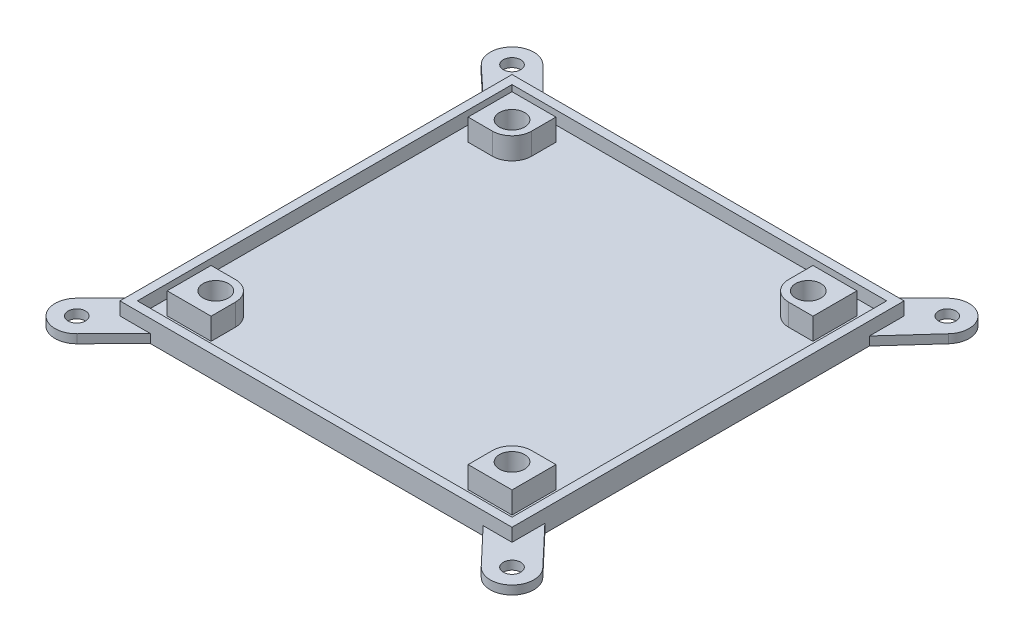
from build123d import *

# Parameters (mm, degrees)
BOSS_EXTRUDE1_DEPTH  = 5
BOSS_EXTRUDE2_DEPTH  = 2
SKETCH1_9_R          = 2.9
BOSS_EXTRUDE11_DEPTH = 7
BOSS_EXTRUDE12_DEPTH = 2
SKETCH2_R            = 2
BOSS_EXTRUDE13_DEPTH = 2


with BuildPart() as part:
    # Sketch1 → Boss-Extrude1 (new body)
    with BuildSketch(Plane(origin=(0, 0, 0), x_dir=(1, 0, 0), z_dir=(0, 1, 0))):
        Polygon((-170.560874466, -191.147776914), (-168.560874466, -191.147776914), (-168.560874466, -101.147776914), (-258.560874466, -101.147776914), (-258.560874466, -191.147776914), align=None)
        Polygon((-170.560874466, -103.147776914), (-170.560874466, -189.147776914), (-173.980874466, -189.147776914), (-256.560874466, -189.147776914), (-256.560874466, -103.147776914), align=None, mode=Mode.SUBTRACT)
    extrude(amount=BOSS_EXTRUDE1_DEPTH)

    # Sketch1<3> → Boss-Extrude2 (add)
    with BuildSketch(Plane(origin=(0, 0, 0), x_dir=(1, 0, 0), z_dir=(0, 1, 0))):
        Polygon((-173.980874466, -189.147776914), (-170.560874466, -189.147776914), (-170.560874466, -103.147776914), (-256.560874466, -103.147776914), (-256.560874466, -189.147776914), align=None)
        Polygon((-173.980874466, -175.647776914), (-173.980874466, -185.727776914), (-176.060874466, -185.727776914), (-184.060874466, -185.727776914), (-243.060874466, -185.727776914), (-253.140874466, -185.727776914), (-253.140874466, -175.647776914), (-253.140874466, -116.647776914), (-253.140874466, -106.567776914), (-243.060874466, -106.567776914), (-184.060874466, -106.567776914), (-173.980874466, -106.567776914), (-173.980874466, -116.647776914), align=None, mode=Mode.SUBTRACT)
    extrude(amount=BOSS_EXTRUDE2_DEPTH)

    # Sketch1<9> → Boss-Extrude11 (add)
    # profile 1 of 4: a face of its own
    with BuildSketch(Plane(origin=(0, 0, 0), x_dir=(1, 0, 0), z_dir=(0, 1, 0))):
        with BuildLine():
            Line((-173.980874466, -185.727776914), (-173.980874466, -175.647776914))
            Line((-173.980874466, -175.647776914), (-179.560874466, -175.647776914))
            ThreePointArc((-179.560874466, -175.647776914), (-182.742854981, -176.965796398), (-184.060874466, -180.147776914))
            Line((-184.060874466, -180.147776914), (-184.060874466, -185.727776914))
            Line((-184.060874466, -185.727776914), (-173.980874466, -185.727776914))
        make_face()
        with Locations((-179.560874466, -180.147776914)):
            Circle(SKETCH1_9_R, mode=Mode.SUBTRACT)
    # profile 2 of 4: a face of its own
    with BuildSketch(Plane(origin=(0, 0, 0), x_dir=(1, 0, 0), z_dir=(0, 1, 0))):
        with BuildLine():
            Line((-173.980874466, -116.647776914), (-173.980874466, -106.567776914))
            Line((-173.980874466, -106.567776914), (-184.060874466, -106.567776914))
            Line((-184.060874466, -106.567776914), (-184.060874466, -112.147776914))
            ThreePointArc((-184.060874466, -112.147776914), (-182.742854981, -115.329757429), (-179.560874466, -116.647776914))
            Line((-179.560874466, -116.647776914), (-173.980874466, -116.647776914))
        make_face()
        with Locations((-179.560874466, -112.147776914)):
            Circle(SKETCH1_9_R, mode=Mode.SUBTRACT)
    # profile 3 of 4: a face of its own
    with BuildSketch(Plane(origin=(0, 0, 0), x_dir=(1, 0, 0), z_dir=(0, 1, 0))):
        with BuildLine():
            Line((-253.140874466, -185.727776914), (-243.060874466, -185.727776914))
            Line((-243.060874466, -185.727776914), (-243.060874466, -180.147776914))
            ThreePointArc((-243.060874466, -180.147776914), (-244.378893951, -176.965796398), (-247.560874466, -175.647776914))
            Line((-247.560874466, -175.647776914), (-253.140874466, -175.647776914))
            Line((-253.140874466, -175.647776914), (-253.140874466, -185.727776914))
        make_face()
        with Locations((-247.560874466, -180.147776914)):
            Circle(SKETCH1_9_R, mode=Mode.SUBTRACT)
    # profile 4 of 4: a face of its own
    with BuildSketch(Plane(origin=(0, 0, 0), x_dir=(1, 0, 0), z_dir=(0, 1, 0))):
        with BuildLine():
            Line((-243.060874466, -106.567776914), (-253.140874466, -106.567776914))
            Line((-253.140874466, -106.567776914), (-253.140874466, -116.647776914))
            Line((-253.140874466, -116.647776914), (-247.560874466, -116.647776914))
            ThreePointArc((-247.560874466, -116.647776914), (-244.378893951, -115.329757429), (-243.060874466, -112.147776914))
            Line((-243.060874466, -112.147776914), (-243.060874466, -106.567776914))
        make_face()
        with Locations((-247.560874466, -112.147776914)):
            Circle(SKETCH1_9_R, mode=Mode.SUBTRACT)
    extrude(amount=BOSS_EXTRUDE11_DEPTH)

    # Sketch1<10> → Boss-Extrude12 (add)
    with BuildSketch(Plane(origin=(0, 0, 0), x_dir=(1, 0, 0), z_dir=(0, 1, 0))):
        with BuildLine():
            Line((-173.980874466, -175.647776914), (-173.980874466, -116.647776914))
            Line((-173.980874466, -116.647776914), (-179.560874466, -116.647776914))
            ThreePointArc((-179.560874466, -116.647776914), (-182.742854981, -115.329757429), (-184.060874466, -112.147776914))
            Line((-184.060874466, -112.147776914), (-184.060874466, -106.567776914))
            Line((-184.060874466, -106.567776914), (-243.060874466, -106.567776914))
            Line((-243.060874466, -106.567776914), (-243.060874466, -112.147776914))
            ThreePointArc((-243.060874466, -112.147776914), (-244.378893951, -115.329757429), (-247.560874466, -116.647776914))
            Line((-247.560874466, -116.647776914), (-253.140874466, -116.647776914))
            Line((-253.140874466, -116.647776914), (-253.140874466, -175.647776914))
            Line((-253.140874466, -175.647776914), (-247.560874466, -175.647776914))
            ThreePointArc((-247.560874466, -175.647776914), (-244.378893951, -176.965796398), (-243.060874466, -180.147776914))
            Line((-243.060874466, -180.147776914), (-243.060874466, -185.727776914))
            Line((-243.060874466, -185.727776914), (-184.060874466, -185.727776914))
            Line((-184.060874466, -185.727776914), (-184.060874466, -180.147776914))
            ThreePointArc((-184.060874466, -180.147776914), (-182.742854981, -176.965796398), (-179.560874466, -175.647776914))
            Line((-179.560874466, -175.647776914), (-173.980874466, -175.647776914))
        make_face()
    extrude(amount=BOSS_EXTRUDE12_DEPTH)

    # Sketch2 → Boss-Extrude13 (add)
    # profile 1 of 4: a face of its own
    with BuildSketch(Plane.XZ):
        with BuildLine():
            Line((-168.560874466, 109.105835649), (-168.560874466, 101.147776914))
            Line((-168.560874466, 101.147776914), (-175.623402457, 101.147776914))
            Line((-175.623402457, 101.147776914), (-167.316099349, 92.840473806))
            ThreePointArc((-167.316099349, 92.840473806), (-160.253571358, 92.493057094), (-159.906154646, 99.555585085))
            Line((-159.906154646, 99.555585085), (-168.560874466, 109.105835649))
        make_face()
        with Locations((-163.611126998, 96.198029445)):
            Circle(SKETCH2_R, mode=Mode.SUBTRACT)
    # profile 2 of 4: a face of its own
    with BuildSketch(Plane.XZ):
        with BuildLine():
            Line((-260.100590579, 92.541297823), (-251.494111489, 101.147776914))
            Line((-251.494111489, 101.147776914), (-258.560874466, 101.147776914))
            Line((-258.560874466, 101.147776914), (-258.560874466, 107.650550002))
            Line((-258.560874466, 107.650550002), (-266.92065329, 99.854761067))
            ThreePointArc((-266.92065329, 99.854761067), (-267.167353556, 92.78799809), (-260.100590579, 92.541297823))
        make_face()
        with Locations((-263.510621934, 96.198029445)):
            Circle(SKETCH2_R, mode=Mode.SUBTRACT)
    # profile 3 of 4: a face of its own
    with BuildSketch(Plane.XZ):
        with BuildLine():
            Line((-168.560874466, 191.147776914), (-168.560874466, 183.611676585))
            Line((-168.560874466, 183.611676585), (-159.983076201, 192.656994276))
            ThreePointArc((-159.983076201, 192.656994276), (-160.170596891, 199.725575179), (-167.239177795, 199.538054488))
            Line((-167.239177795, 199.538054488), (-175.195792575, 191.147776914))
            Line((-175.195792575, 191.147776914), (-168.560874466, 191.147776914))
        make_face()
        with Locations((-163.611126998, 196.097524382)):
            Circle(SKETCH2_R, mode=Mode.SUBTRACT)
    # profile 4 of 4: a face of its own
    with BuildSketch(Plane.XZ):
        with BuildLine():
            Line((-267.068077111, 192.584048515), (-258.560874466, 183.970358473))
            Line((-258.560874466, 183.970358473), (-258.560874466, 191.147776914))
            Line((-258.560874466, 191.147776914), (-251.594570664, 191.147776914))
            Line((-251.594570664, 191.147776914), (-259.953166758, 199.611000249))
            ThreePointArc((-259.953166758, 199.611000249), (-267.024097801, 199.654979559), (-267.068077111, 192.584048515))
        make_face()
        with Locations((-263.510621934, 196.097524382)):
            Circle(SKETCH2_R, mode=Mode.SUBTRACT)
    extrude(amount=-BOSS_EXTRUDE13_DEPTH)


solid = part.part
